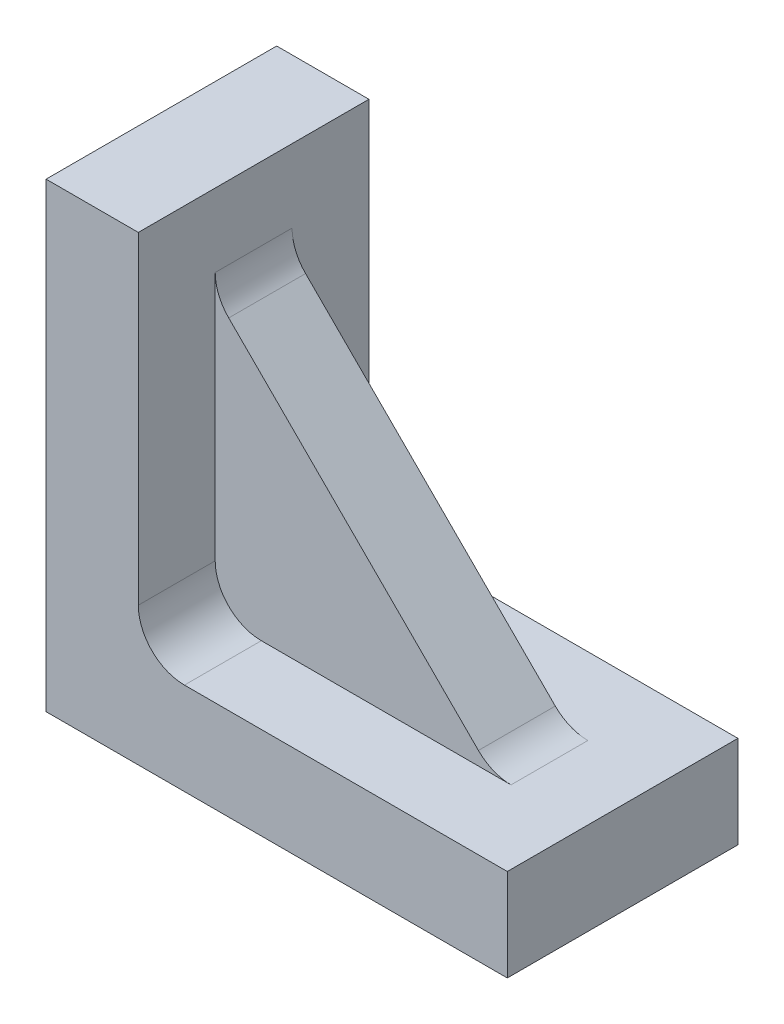
from build123d import *

# Parameters (mm, degrees)
BOSS_EXTRUDE1_DEPTH = 12.7
SKETCH3_W           = 4.233333333
SKETCH3_H           = 15.24
CUT_EXTRUDE1_DEPTH  = 20.32
FILLET1_R           = 2.54
FILLET2_R           = 2.54
SCALE1_SCALE        = 3


with BuildPart() as part:
    # Sketch1 → Boss-Extrude1 (new body)
    with BuildSketch(Plane.XY):
        Polygon((0, 0), (0, 25.4), (5.08, 25.4), (5.08, 20.32), (20.32, 5.08), (25.4, 5.08), (25.4, 0), align=None)
    extrude(amount=BOSS_EXTRUDE1_DEPTH)

    # Sketch3 → Cut-Extrude1 (cut)
    with BuildSketch(Plane(origin=(25.4, 0, 0), x_dir=(0, 0, -1), z_dir=(1, 0, 0))):
        with Locations((-10.583333334, 12.7)):
            Rectangle(SKETCH3_W, SKETCH3_H)
        with Locations((-2.116666667, 12.7)):
            Rectangle(SKETCH3_W, SKETCH3_H)
    extrude(amount=-CUT_EXTRUDE1_DEPTH, mode=Mode.SUBTRACT)

    # Fillet1
    fillet1_edges = [part.edges().sort_by_distance(p)[0] for p in [
        (5.08, 5.08, 10.583333333),
        (5.08, 5.08, 2.116666667),
    ]]
    fillet(fillet1_edges, radius=FILLET1_R)

    # Fillet2
    fillet2_edges = [part.edges().sort_by_distance(p)[0] for p in [
        (5.08, 20.32, 6.35),
        (20.32, 5.08, 6.35),
    ]]
    fillet(fillet2_edges, radius=FILLET2_R)


with BuildPart() as part_1:
    # Scale1: scaled about (8.45857593, 8.45857593, 6.35)
    add(part.part.scale(SCALE1_SCALE).moved(Location((-16.91715186, -16.91715186, -12.7))))


solid = part_1.part
